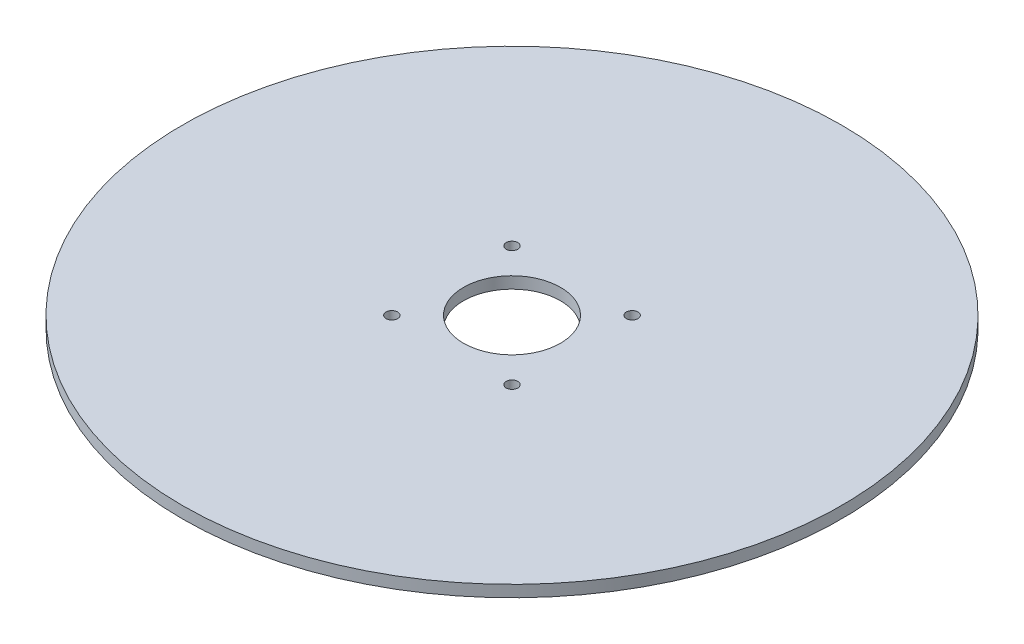
from build123d import *

# Parameters (mm, degrees)
SKETCH1_R           = 85
SKETCH1_R_2         = 12.5
BOSS_EXTRUDE1_DEPTH = 3
CUT_EXTRUDE1_DEPTH  = 10


with BuildPart() as part:
    # Sketch1 → Boss-Extrude1 (new body)
    with BuildSketch(Plane(origin=(0, 0, 0), x_dir=(1, 0, 0), z_dir=(0, 1, 0))):
        with Locations(Location((0, 0, 0), (0, 0, 270))):
            Circle(SKETCH1_R)
        with Locations(Location((0, 0, 0), (0, 0, 270))):
            Circle(SKETCH1_R_2, mode=Mode.SUBTRACT)
    extrude(amount=BOSS_EXTRUDE1_DEPTH)

    # Sketch2 → Cut-Extrude1 (cut)
    with BuildSketch(Plane(origin=(0, 3, 0), x_dir=(1, 0, 0), z_dir=(0, 1, 0))):
        with BuildLine():
            ThreePointArc((-14, 15.5), (-16.560660172, 16.560660172), (-15.5, 14))
            Line((-15.5, 14), (-15.5, 15.5))
            Line((-15.5, 15.5), (-14, 15.5))
        make_face()
        with BuildLine():
            Line((-15.5, 15.5), (-15.5, 14))
            ThreePointArc((-15.5, 14), (-14.439339828, 14.439339828), (-14, 15.5))
            Line((-14, 15.5), (-15.5, 15.5))
        make_face()
        with BuildLine():
            ThreePointArc((14, 15.5), (14.439339828, 14.439339828), (15.5, 14))
            Line((15.5, 14), (15.5, 15.5))
            Line((15.5, 15.5), (14, 15.5))
        make_face()
        with BuildLine():
            Line((15.5, 15.5), (15.5, 14))
            ThreePointArc((15.5, 14), (16.560660172, 14.439339828), (17, 15.5))
            ThreePointArc((17, 15.5), (15.5, 17), (14, 15.5))
            Line((14, 15.5), (15.5, 15.5))
        make_face()
        with BuildLine():
            ThreePointArc((15.5, -14), (14.439339828, -14.439339828), (14, -15.5))
            Line((14, -15.5), (15.5, -15.5))
            Line((15.5, -15.5), (15.5, -14))
        make_face()
        with BuildLine():
            Line((15.5, -15.5), (14, -15.5))
            ThreePointArc((14, -15.5), (15.5, -17), (17, -15.5))
            ThreePointArc((17, -15.5), (16.560660172, -14.439339828), (15.5, -14))
            Line((15.5, -14), (15.5, -15.5))
        make_face()
        with BuildLine():
            Line((-15.5, -14), (-15.5, -15.5))
            Line((-15.5, -15.5), (-14, -15.5))
            ThreePointArc((-14, -15.5), (-14.439339828, -14.439339828), (-15.5, -14))
        make_face()
        with BuildLine():
            Line((-14, -15.5), (-15.5, -15.5))
            Line((-15.5, -15.5), (-15.5, -14))
            ThreePointArc((-15.5, -14), (-16.560660172, -16.560660172), (-14, -15.5))
        make_face()
    extrude(amount=-CUT_EXTRUDE1_DEPTH, mode=Mode.SUBTRACT)


solid = part.part
